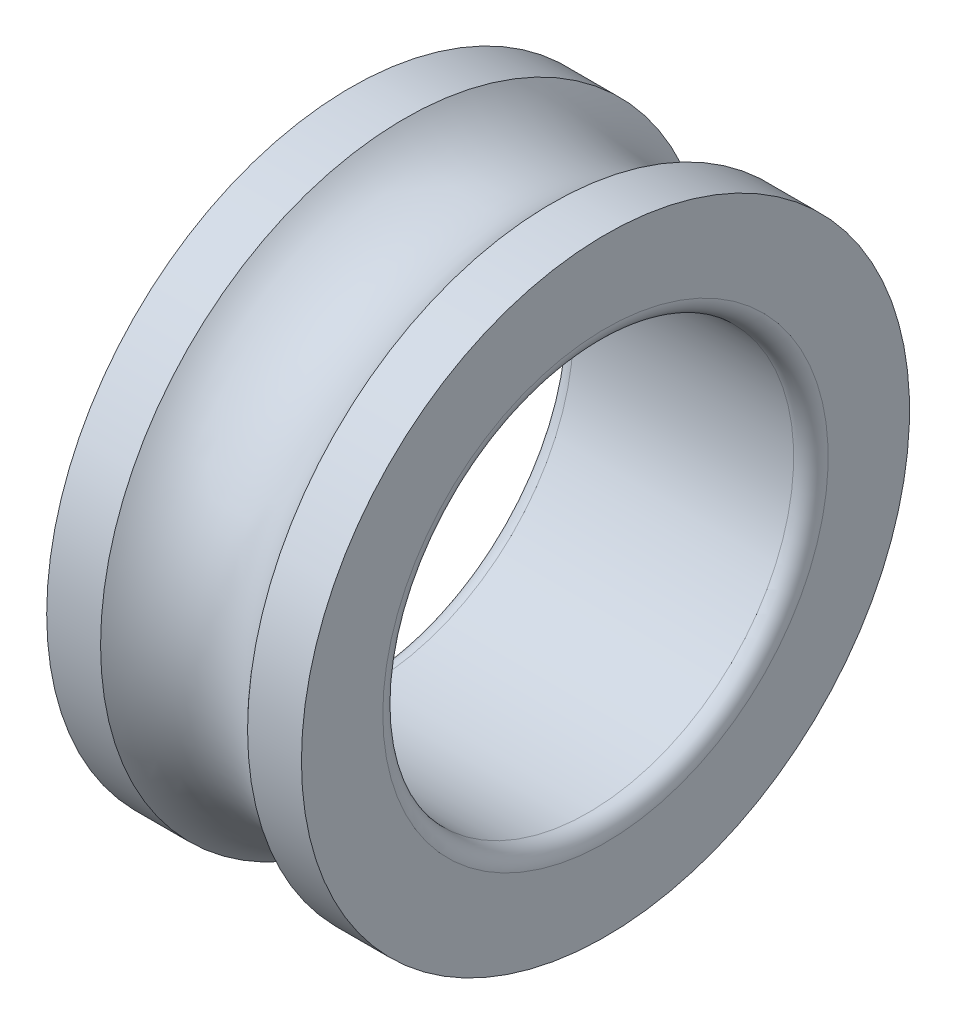
from build123d import *


with BuildPart() as part:
    # Sketch1 → Revolve1 (revolve)
    with BuildSketch(Plane.XY, mode=Mode.PRIVATE) as revolve1_sk:
        with BuildLine():
            Line((-15.5, 37), (-8.94427191, 37))
            ThreePointArc((-8.94427191, 37), (0, 33), (8.94427191, 37))
            Line((8.94427191, 37), (15.5, 37))
            Line((15.5, 37), (15.5, 27.1))
            ThreePointArc((15.5, 27.1), (14.88492424, 25.61507576), (13.4, 25))
            Line((13.4, 25), (-13.4, 25))
            ThreePointArc((-13.4, 25), (-14.88492424, 25.61507576), (-15.5, 27.1))
            Line((-15.5, 27.1), (-15.5, 37))
        make_face()
    revolve(revolve1_sk.sketch.rotate(Axis((-26.755952381, 0, 0), (1, 0, 0)), 90), axis=Axis((-26.755952381, 0, 0), (1, 0, 0)))


solid = part.part
